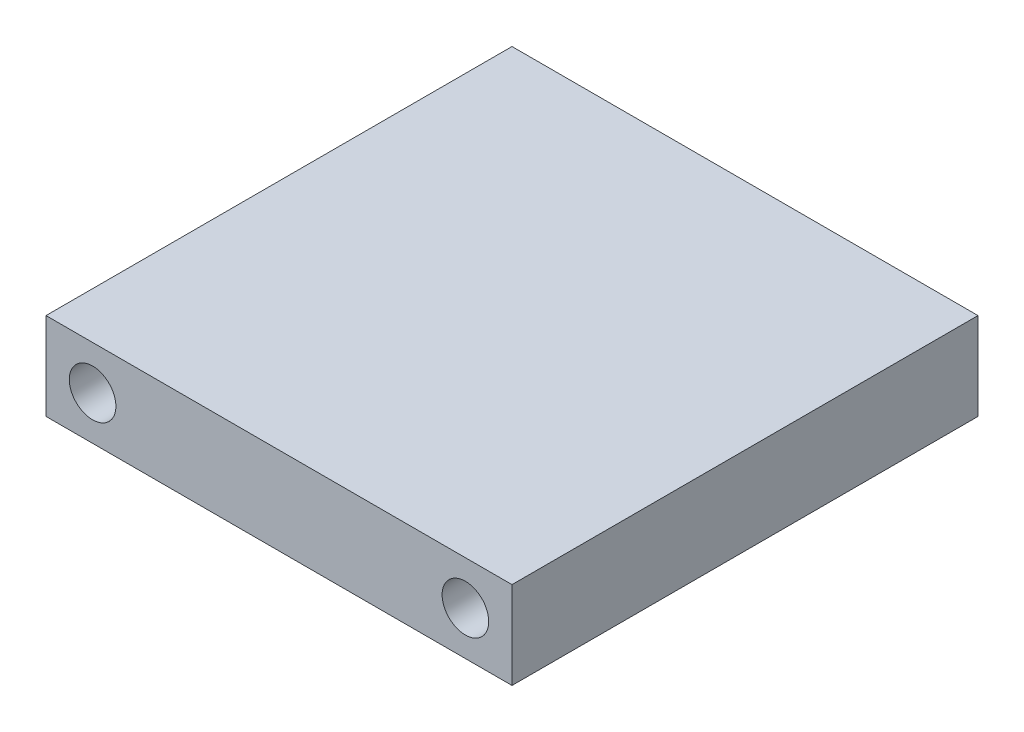
from build123d import *

# Parameters (mm, degrees)
SKETCH2_W                 = 50.8
SKETCH2_H                 = 50.8
BOSS_EXTRUDE1_DEPTH       = 9.525
F_6_32_TAPPED_HOLE1_D     = 2.7051
F_6_32_TAPPED_HOLE1_DEPTH = 9.398
F_6_32_TAPPED_HOLE1_TIP   = 0.81269403
F_6_32_TAPPED_HOLE2_D     = 2.7051
F_6_32_TAPPED_HOLE2_DEPTH = 9.398
F_6_32_TAPPED_HOLE2_TIP   = 0.81269403
SKETCH3_R                 = 2.54
CUT_EXTRUDE1_DEPTH        = 58.589283942


with BuildPart() as part:
    # Sketch2 → Boss-Extrude1 (new body)
    with BuildSketch(Plane(origin=(0, 0, 0), x_dir=(1, 0, 0), z_dir=(0, 1, 0))):
        Rectangle(SKETCH2_W, SKETCH2_H)
    extrude(amount=BOSS_EXTRUDE1_DEPTH)

    # #6-32 Tapped Hole1
    with Locations(Plane.XY.offset(25.4)):
        with Locations((-20.32, 4.7625), (20.32, 4.7625)):
            Hole(F_6_32_TAPPED_HOLE1_D / 2, depth=F_6_32_TAPPED_HOLE1_DEPTH)
            with Locations((0, 0, -(F_6_32_TAPPED_HOLE1_DEPTH + F_6_32_TAPPED_HOLE1_TIP / 2))):  # 118° drill point
                Cone(0, F_6_32_TAPPED_HOLE1_D / 2, F_6_32_TAPPED_HOLE1_TIP, mode=Mode.SUBTRACT)

    # #6-32 Tapped Hole2
    with Locations(Plane(origin=(0, 0, -25.4), x_dir=(-1, 0, 0), z_dir=(0, 0, -1))):
        with Locations((-20.32, 4.7625), (20.32, 4.7625)):
            Hole(F_6_32_TAPPED_HOLE2_D / 2, depth=F_6_32_TAPPED_HOLE2_DEPTH)
            with Locations((0, 0, -(F_6_32_TAPPED_HOLE2_DEPTH + F_6_32_TAPPED_HOLE2_TIP / 2))):  # 118° drill point
                Cone(0, F_6_32_TAPPED_HOLE2_D / 2, F_6_32_TAPPED_HOLE2_TIP, mode=Mode.SUBTRACT)

    # Sketch3 → Cut-Extrude1 (cut, through all)
    with BuildSketch(Plane.XY.offset(25.4)):
        with Locations((20.32, 4.7625)):
            Circle(SKETCH3_R)
        with Locations((-20.32, 4.7625)):
            Circle(SKETCH3_R)
    extrude(amount=-CUT_EXTRUDE1_DEPTH, mode=Mode.SUBTRACT)


solid = part.part
